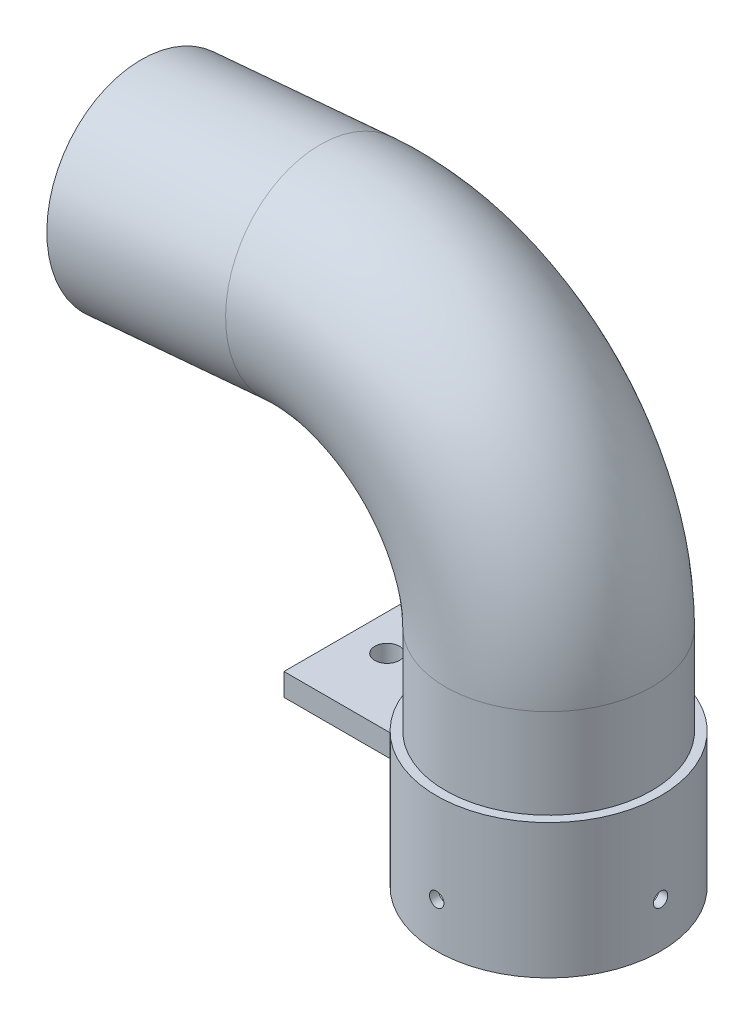
from build123d import *

# Parameters (mm, degrees)
SKETCH_1_R               = 23
SKETCH_1_R_2             = 21
EXTRUDE_1_DEPTH          = 20
EXTRUDE_1_DEPTH_BACK     = 10
SKETCH_3_R               = 25
SKETCH_3_R_2             = 23
SKETCH_5_R               = 2.75
EXTRUDE_3_DEPTH          = 5
CUT_EXTRUDE_1_DEPTH      = 136.900654152
CUT_EXTRUDE_1_DEPTH_BACK = 136.900654152
SKETCH_6_R               = 1.6
CUT_EXTRUDE_2_DEPTH      = 136.900654171
CUT_EXTRUDE_2_DEPTH_BACK = 136.900654171
SKETCH_7_R               = 1.6


with BuildPart() as part:
    # 扫描1: sweep along a path in 草图2
    with BuildLine(Plane.XY) as sweep_1_path:
        Line((0, 0), (0, 30))
        ThreePointArc((0, 30), (-14.598440657, 63.177480156), (-48.922008424, 74.828761414))
        Line((-48.922008424, 74.828761414), (-88.769796347, 71.342531704))
    # 草图1 → 扫描1 (sweep)
    with BuildSketch(Plane(origin=(0, 0, 0), x_dir=(1, 0, 0), z_dir=(0, 1, 0))):
        Circle(SKETCH_1_R)
        Circle(SKETCH_1_R_2, mode=Mode.SUBTRACT)
    sweep(path=sweep_1_path.line)


with BuildPart() as body_2:
    # 草图3 → 凸台-拉伸1 (new, two sides: drawn at the far end of the back side and taken through both)
    with BuildSketch(Plane(origin=(0, 0, 58.765701135), x_dir=(1, 0, 0), z_dir=(0, -1, 0)).offset(-EXTRUDE_1_DEPTH_BACK)):
        with Locations(Location((0, -58.765701135, 0), (0, 0, 270))):
            Circle(SKETCH_3_R)
        with Locations(Location((0, -58.765701135, 0), (0, 0, 270))):
            Circle(SKETCH_3_R_2, mode=Mode.SUBTRACT)
    extrude(amount=EXTRUDE_1_DEPTH + EXTRUDE_1_DEPTH_BACK)


    add(part.part)  # 凸台-拉伸3 merges part
    # 草图5 → 凸台-拉伸3 (add)
    with BuildSketch(Plane(origin=(0, 2, 0), x_dir=(-1, 0, 0), z_dir=(0, -1, 0))):
        with BuildLine():
            Line((20, 15), (44, 15))
            Line((44, 15), (44, -15))
            Line((44, -15), (20, -15))
            ThreePointArc((20, -15), (25, 0), (20, 15))
        make_face()
        with Locations(Location((36, 0, 0), (0, 0, 90))):
            Circle(SKETCH_5_R, mode=Mode.SUBTRACT)
    extrude(amount=-EXTRUDE_3_DEPTH)

    # 草图6 → 切除-拉伸1 (cut, two sides: drawn at the far end of the back side and taken through both)
    with BuildSketch(Plane(origin=(0, 0, 0), x_dir=(0, 0, -1), z_dir=(1, 0, 0)).offset(-CUT_EXTRUDE_1_DEPTH_BACK)):
        with Locations((0, -10)):
            Circle(SKETCH_6_R)
    extrude(amount=CUT_EXTRUDE_1_DEPTH + CUT_EXTRUDE_1_DEPTH_BACK, mode=Mode.SUBTRACT)

    # 草图7 → 切除-拉伸2 (cut, two sides: drawn at the far end of the back side and taken through both)
    with BuildSketch(Plane.XY.offset(-CUT_EXTRUDE_2_DEPTH_BACK)):
        with Locations((0, -10)):
            Circle(SKETCH_7_R)
    extrude(amount=CUT_EXTRUDE_2_DEPTH + CUT_EXTRUDE_2_DEPTH_BACK, mode=Mode.SUBTRACT)


solid = body_2.part
